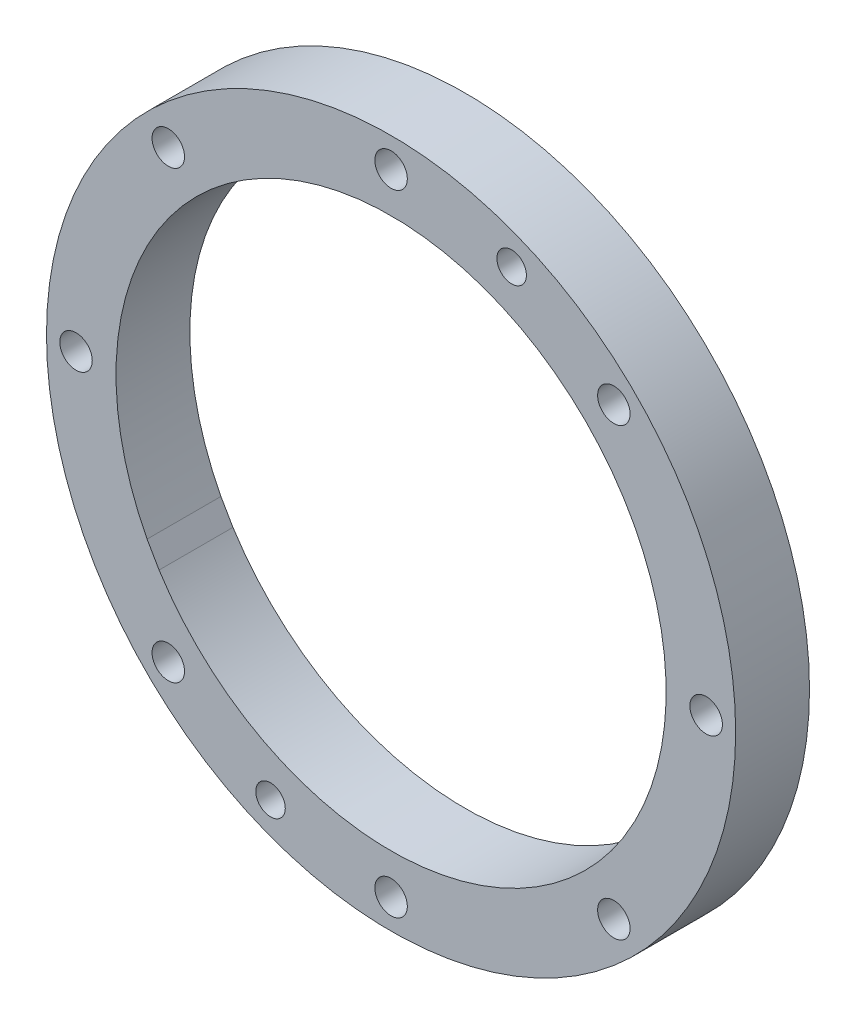
from build123d import *

# Parameters (mm, degrees)
SKETCH1_R           = 70
SKETCH1_R_2         = 3.3
SKETCH1_R_3         = 3
BOSS_EXTRUDE1_DEPTH = 7.5


with BuildPart() as part:
    # Sketch1 → Boss-Extrude1 (new, symmetric)
    with BuildSketch(Plane.XY):
        Circle(SKETCH1_R)
        with Locations((64, 0)):
            Circle(SKETCH1_R_2, mode=Mode.SUBTRACT)
        with Locations((45.254833996, 45.254833996)):
            Circle(SKETCH1_R_2, mode=Mode.SUBTRACT)
        with Locations((0, 64)):
            Circle(SKETCH1_R_2, mode=Mode.SUBTRACT)
        with Locations((-45.254833996, 45.254833996)):
            Circle(SKETCH1_R_2, mode=Mode.SUBTRACT)
        with Locations((-64, 0)):
            Circle(SKETCH1_R_2, mode=Mode.SUBTRACT)
        with Locations((-45.254833996, -45.254833996)):
            Circle(SKETCH1_R_2, mode=Mode.SUBTRACT)
        with Locations((0, -64)):
            Circle(SKETCH1_R_2, mode=Mode.SUBTRACT)
        with Locations((45.254833996, -45.254833996)):
            Circle(SKETCH1_R_2, mode=Mode.SUBTRACT)
        with Locations((24.491739671, 59.128290081)):
            Circle(SKETCH1_R_3, mode=Mode.SUBTRACT)
        with Locations((-24.491739671, -59.128290081)):
            Circle(SKETCH1_R_3, mode=Mode.SUBTRACT)
        with BuildLine():
            Line((2.437233269, 55.821819381), (-2.437233269, 55.821819381))
            ThreePointArc((-2.437233269, 55.821819381), (-48.389169436, 27.9375), (-49.561730304, -25.800203765))
            Line((-49.561730304, -25.800203765), (-47.124497035, -30.021615616))
            ThreePointArc((-47.124497035, -30.021615616), (0, -55.875), (47.124497035, -30.021615616))
            Line((47.124497035, -30.021615616), (49.561730304, -25.800203765))
            ThreePointArc((49.561730304, -25.800203765), (48.389169436, 27.9375), (2.437233269, 55.821819381))
        make_face(mode=Mode.SUBTRACT)
    extrude(amount=BOSS_EXTRUDE1_DEPTH, both=True)


solid = part.part
